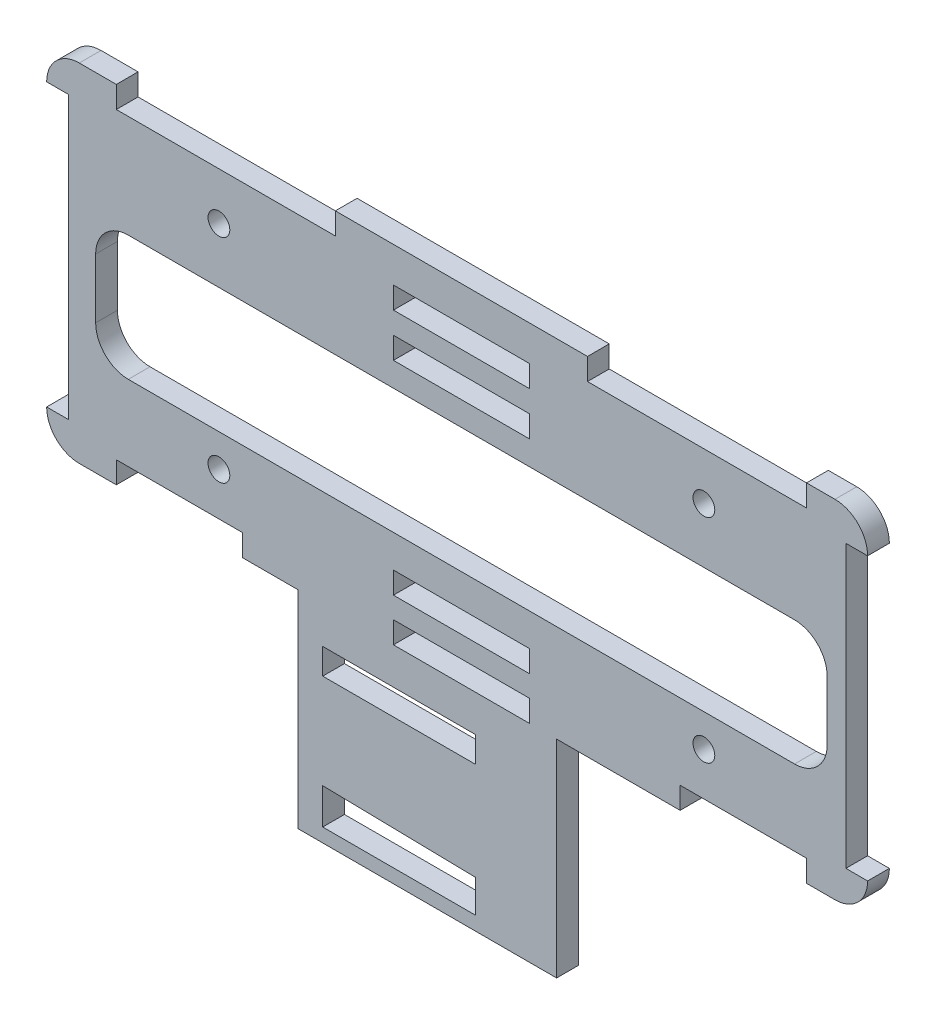
from build123d import *

# Parameters (mm, degrees)
SKETCH1_R           = 2.54
SKETCH1_W           = 31.75
SKETCH1_H           = 5.08
BOSS_EXTRUDE1_DEPTH = 5.08


with BuildPart() as part:
    # Sketch1 → Boss-Extrude1 (new body)
    with BuildSketch(Plane.XY):
        with BuildLine():
            Line((73.443857446, 124.317776281), (22.310144528, 124.317776281))
            Line((22.310144528, 124.317776281), (22.310144528, 129.397776281))
            Line((22.310144528, 129.397776281), (14.0979145, 129.397776281))
            Line((14.0979145, 129.397776281), (-30.3520855, 129.397776281))
            Line((-30.3520855, 129.397776281), (-36.559880198, 129.397776281))
            Line((-36.559880198, 129.397776281), (-36.559880198, 124.317776281))
            Line((-36.559880198, 124.317776281), (-87.693593116, 124.317776281))
            Line((-87.693593116, 124.317776281), (-87.693593116, 129.397776281))
            Line((-87.693593116, 129.397776281), (-96.342075919, 129.397776281))
            ThreePointArc((-96.342075919, 129.397776281), (-101.730229592, 127.165929953), (-103.962075919, 121.777776281))
            Line((-103.962075919, 121.777776281), (-98.882075919, 121.777776281))
            Line((-98.882075919, 121.777776281), (-98.882075919, 56.048326859))
            Line((-98.882075919, 56.048326859), (-103.962075919, 56.048326859))
            ThreePointArc((-103.962075919, 56.048326859), (-101.730229592, 50.660173186), (-96.342075919, 48.428326859))
            Line((-96.342075919, 48.428326859), (-87.693593116, 48.428326859))
            Line((-87.693593116, 48.428326859), (-87.693593116, 53.508326859))
            Line((-87.693593116, 53.508326859), (-58.190357776, 53.508326859))
            Line((-58.190357776, 53.508326859), (-58.190357776, 48.428326859))
            Line((-58.190357776, 48.428326859), (-45.221913897, 48.428326859))
            Line((-45.221913897, 48.428326859), (-45.221913897, 0.116289741))
            Line((-45.221913897, 0.116289741), (-7.123980427, 0.116289741))
            Line((-7.123980427, 0.116289741), (15.101019573, 0.116289741))
            Line((15.101019573, 0.116289741), (15.101019573, 48.428326859))
            Line((15.101019573, 48.428326859), (32.202561113, 48.428326859))
            Line((32.202561113, 48.428326859), (43.940622107, 48.428326859))
            Line((43.940622107, 48.428326859), (43.940622107, 53.508326859))
            Line((43.940622107, 53.508326859), (73.443857446, 53.508326859))
            Line((73.443857446, 53.508326859), (73.443857446, 48.428326859))
            Line((73.443857446, 48.428326859), (80.087904918, 48.428326859))
            ThreePointArc((80.087904918, 48.428326859), (85.476058591, 50.660173186), (87.707904918, 56.048326859))
            Line((87.707904918, 56.048326859), (82.627904918, 56.048326859))
            Line((82.627904918, 56.048326859), (82.627904918, 116.106668145))
            Line((82.627904918, 116.106668145), (82.627904918, 121.777776281))
            Line((82.627904918, 121.777776281), (87.707904918, 121.777776281))
            ThreePointArc((87.707904918, 121.777776281), (85.476058591, 127.165929953), (80.087904918, 129.397776281))
            Line((80.087904918, 129.397776281), (73.443857446, 129.397776281))
            Line((73.443857446, 129.397776281), (73.443857446, 124.317776281))
        make_face()
        Polygon((-3.872275334, 3.339373144), (-39.506956929, 3.339373144), (-39.506956929, 11.703040428), (-3.872275334, 10.997950476), align=None, mode=Mode.SUBTRACT)
        with Locations((-63.737543347, 63.552037118)):
            Circle(SKETCH1_R, mode=Mode.SUBTRACT)
        Polygon((-39.506956929, 39.861286156), (-29.349867835, 39.861286156), (-3.872275334, 39.861286156), (-3.872275334, 33.84416171), (-39.506956929, 33.84416171), align=None, mode=Mode.SUBTRACT)
        with Locations((-7.123980427, 50.968326859)):
            Rectangle(SKETCH1_W, SKETCH1_H, mode=Mode.SUBTRACT)
        with Locations((-7.124867835, 61.012037118)):
            Rectangle(SKETCH1_W, SKETCH1_H, mode=Mode.SUBTRACT)
        with Locations((49.487807678, 63.552037118)):
            Circle(SKETCH1_R, mode=Mode.SUBTRACT)
        with Locations((-63.737543347, 113.231437191)):
            Circle(SKETCH1_R, mode=Mode.SUBTRACT)
        with BuildLine():
            Line((70.649018329, 71.162232039), (-84.898753999, 71.162232039))
            ThreePointArc((-84.898753999, 71.162232039), (-90.286907671, 73.394078367), (-92.518753999, 78.782232039))
            Line((-92.518753999, 78.782232039), (-92.518753999, 92.693311063))
            ThreePointArc((-92.518753999, 92.693311063), (-90.286907671, 98.081464736), (-84.898753999, 100.313311063))
            Line((-84.898753999, 100.313311063), (70.649018329, 100.313311063))
            ThreePointArc((70.649018329, 100.313311063), (76.037172002, 98.081464736), (78.269018329, 92.693311063))
            Line((78.269018329, 92.693311063), (78.269018329, 78.782232039))
            ThreePointArc((78.269018329, 78.782232039), (76.037172002, 73.394078367), (70.649018329, 71.162232039))
        make_face(mode=Mode.SUBTRACT)
        with Locations((-7.124867835, 108.486668145)):
            Rectangle(SKETCH1_W, SKETCH1_H, mode=Mode.SUBTRACT)
        with Locations((-7.124867835, 118.646668145)):
            Rectangle(SKETCH1_W, SKETCH1_H, mode=Mode.SUBTRACT)
        with Locations((49.487807678, 113.231437191)):
            Circle(SKETCH1_R, mode=Mode.SUBTRACT)
    extrude(amount=BOSS_EXTRUDE1_DEPTH)


solid = part.part
